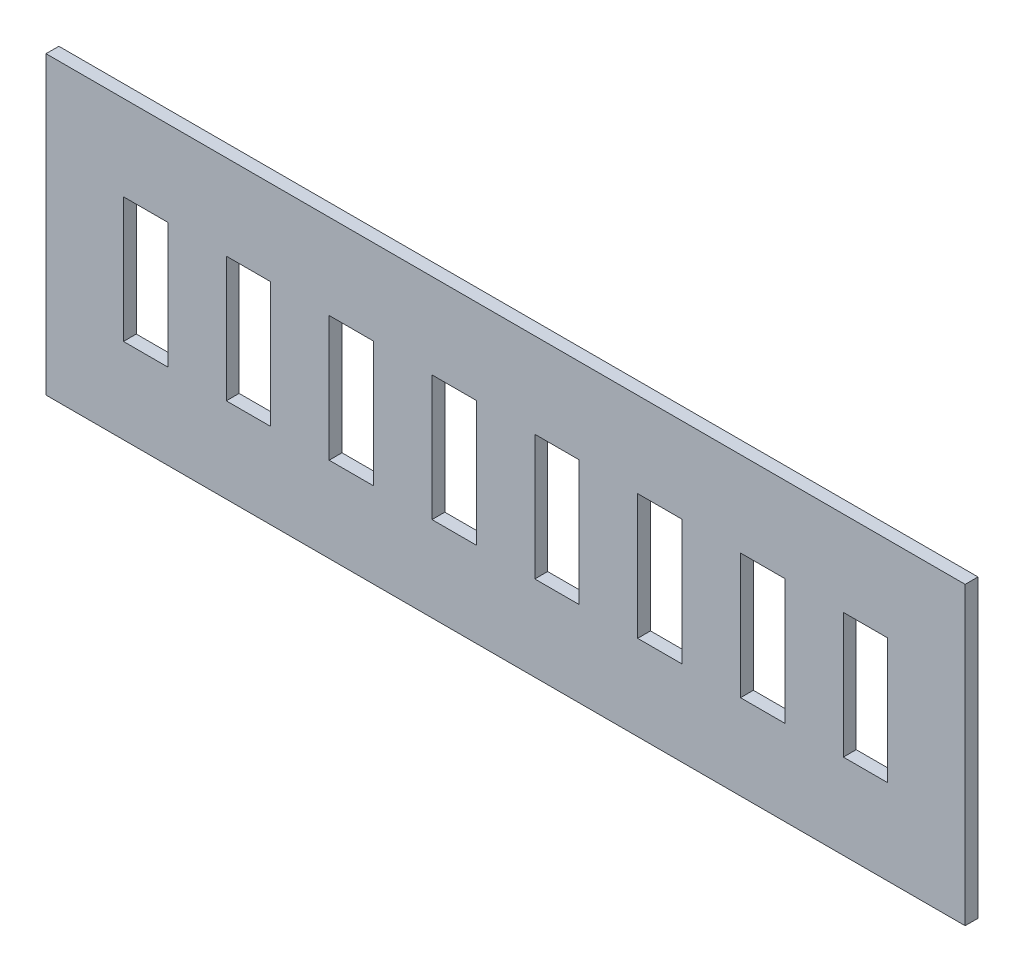
from build123d import *

# Parameters (mm, degrees)
SKETCH1_W           = 1430
SKETCH1_H           = 460
SKETCH1_W_2         = 69
SKETCH1_H_2         = 195
BOSS_EXTRUDE1_DEPTH = 20


with BuildPart() as part:
    # Sketch1 → Boss-Extrude1 (new body)
    with BuildSketch(Plane.XY):
        Rectangle(SKETCH1_W, SKETCH1_H)
        with Locations((-400, 0)):
            Rectangle(SKETCH1_W_2, SKETCH1_H_2, mode=Mode.SUBTRACT)
        with Locations((-560, 0)):
            Rectangle(SKETCH1_W_2, SKETCH1_H_2, mode=Mode.SUBTRACT)
        with Locations((-240, 0)):
            Rectangle(SKETCH1_W_2, SKETCH1_H_2, mode=Mode.SUBTRACT)
        with Locations((-80, 0)):
            Rectangle(SKETCH1_W_2, SKETCH1_H_2, mode=Mode.SUBTRACT)
        with Locations((80, 0)):
            Rectangle(SKETCH1_W_2, SKETCH1_H_2, mode=Mode.SUBTRACT)
        with Locations((240, 0)):
            Rectangle(SKETCH1_W_2, SKETCH1_H_2, mode=Mode.SUBTRACT)
        with Locations((400, 0)):
            Rectangle(SKETCH1_W_2, SKETCH1_H_2, mode=Mode.SUBTRACT)
        with Locations((560, 0)):
            Rectangle(SKETCH1_W_2, SKETCH1_H_2, mode=Mode.SUBTRACT)
    extrude(amount=BOSS_EXTRUDE1_DEPTH)


solid = part.part
